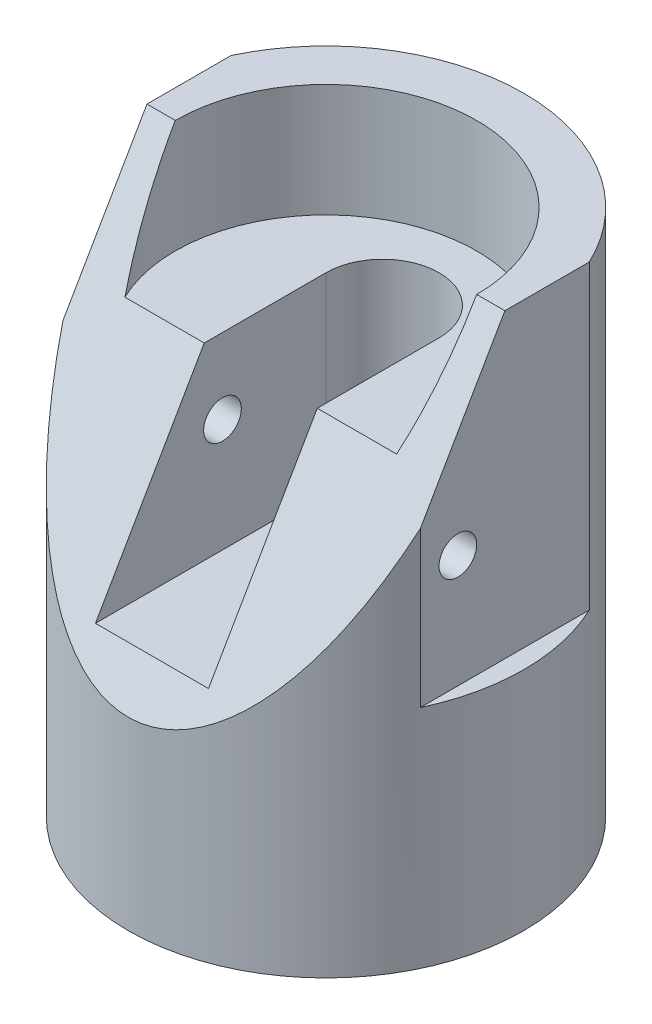
from build123d import *

# Parameters (mm, degrees)
CROQUIS2_W              = 66.675
CROQUIS2_H              = 66.675
SALIENTE_EXTRUIR2_DEPTH = 88.9
CORTAR_EXTRUIR1_DEPTH   = 117.01790608
CROQUIS5_OUTSIDE_W      = 94.593
CROQUIS5_OUTSIDE_H      = 94.593
CROQUIS5_OUTSIDE_R      = 33.3375
CORTAR_EXTRUIR2_DEPTH   = 88.9
CROQUIS6_R              = 25.4
CORTAR_EXTRUIR4_DEPTH   = 19.05
CORTAR_EXTRUIR5_DEPTH   = 31.75
CORTAR_EXTRUIR6_START   = -50.8
CORTAR_EXTRUIR6_DEPTH   = 50.8
CROQUIS9_R              = 3.175
CORTAR_EXTRUIR7_DEPTH   = 60.325


with BuildPart() as part:
    # Croquis2 → Saliente-Extruir2 (new body)
    with BuildSketch(Plane(origin=(0, 0, 0), x_dir=(1, 0, 0), z_dir=(0, 1, 0))):
        Rectangle(CROQUIS2_W, CROQUIS2_H)
    extrude(amount=SALIENTE_EXTRUIR2_DEPTH)

    # Croquis4 → Cortar-Extruir1 (cut, through all)
    with BuildSketch(Plane.ZY.offset(33.3375)):
        Polygon((33.3375, 31.157756203), (0, 88.9), (33.3375, 88.9), align=None)
    extrude(amount=-CORTAR_EXTRUIR1_DEPTH, mode=Mode.SUBTRACT)

    # Croquis5 outside → Cortar-Extruir2 (cut)
    with BuildSketch(Plane.XZ):
        with Locations((-0.0005, 0.0005)):
            Rectangle(CROQUIS5_OUTSIDE_W, CROQUIS5_OUTSIDE_H)
        with Locations(Location((0, 0, 0), (0, 0, 270))):
            Circle(CROQUIS5_OUTSIDE_R, mode=Mode.SUBTRACT)
    extrude(amount=-CORTAR_EXTRUIR2_DEPTH, mode=Mode.SUBTRACT)

    # Croquis6 → Cortar-Extruir4 (cut)
    with BuildSketch(Plane(origin=(0, 88.9, 0), x_dir=(1, 0, 0), z_dir=(0, 1, 0))):
        Circle(CROQUIS6_R)
    extrude(amount=-CORTAR_EXTRUIR4_DEPTH, mode=Mode.SUBTRACT)

    # Croquis7 → Cortar-Extruir5 (cut)
    with BuildSketch(Plane(origin=(0, 69.85, 0), x_dir=(1, 0, 0), z_dir=(0, 1, 0))):
        with BuildLine():
            Line((-9.525, 9.525), (-9.525, -31.947821229))
            Line((-9.525, -31.947821229), (9.525, -31.947821229))
            Line((9.525, -31.947821229), (9.525, 9.525))
            ThreePointArc((9.525, 9.525), (0, 19.05), (-9.525, 9.525))
        make_face()
    extrude(amount=-CORTAR_EXTRUIR5_DEPTH, mode=Mode.SUBTRACT)

    # Croquis8 → Cortar-Extruir6 (cut)
    with BuildSketch(Plane(origin=(0, 88.9, 0), x_dir=(1, 0, 0), z_dir=(0, 1, 0)).offset(CORTAR_EXTRUIR6_START)):
        with BuildLine():
            Line((-30.1752, 14.172022128), (-30.1752, -14.172022128))
            ThreePointArc((-30.1752, -14.172022128), (-33.3375, 0), (-30.1752, 14.172022128))
        make_face()
        with BuildLine():
            Line((30.1498, 14.225978568), (30.1498, -14.225978568))
            ThreePointArc((30.1498, -14.225978568), (33.3375, 0), (30.1498, 14.225978568))
        make_face()
    extrude(amount=CORTAR_EXTRUIR6_DEPTH, mode=Mode.SUBTRACT)

    # Croquis9 → Cortar-Extruir7 (cut)
    with BuildSketch(Plane.ZY.offset(30.1752)):
        with Locations((7.9248, 57.15)):
            Circle(CROQUIS9_R)
    extrude(amount=-CORTAR_EXTRUIR7_DEPTH, mode=Mode.SUBTRACT)


solid = part.part
